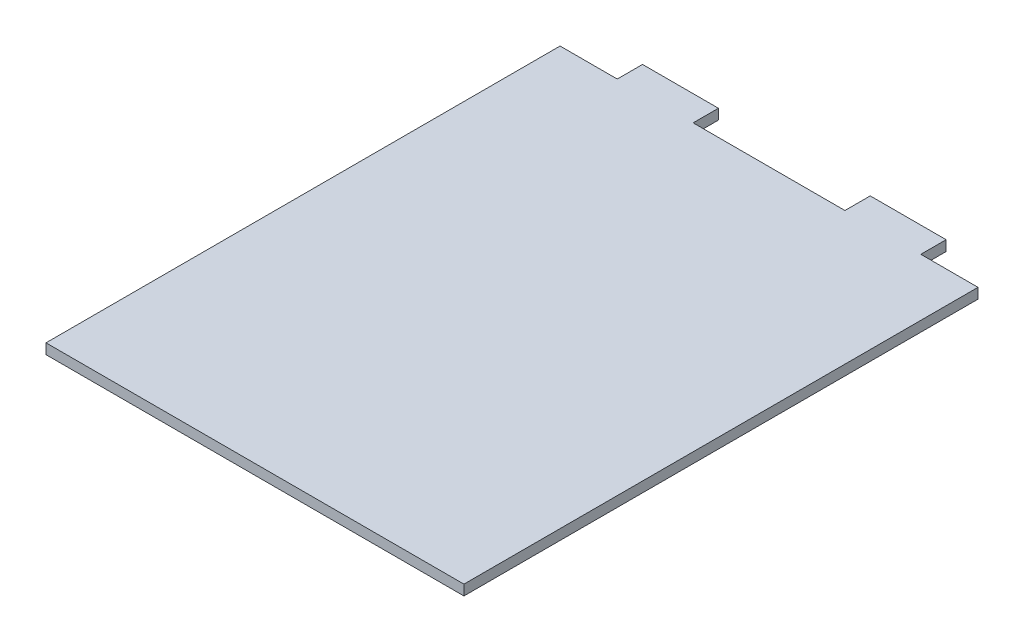
from build123d import *

# Parameters (mm, degrees)
BOSS_EXTRUDE1_DEPTH = 10.16


with BuildPart() as part:
    # Sketch1 → Boss-Extrude1 (new body)
    with BuildSketch(Plane(origin=(0, 0, 0), x_dir=(1, 0, 0), z_dir=(0, 1, 0))):
        Polygon((-206.5, -254), (206.5, -254), (206.5, 254), (150, 254), (150, 279), (75, 279), (75, 254), (-75, 254), (-75, 279), (-150, 279), (-150, 254), (-206.5, 254), align=None)
    extrude(amount=BOSS_EXTRUDE1_DEPTH)


solid = part.part
